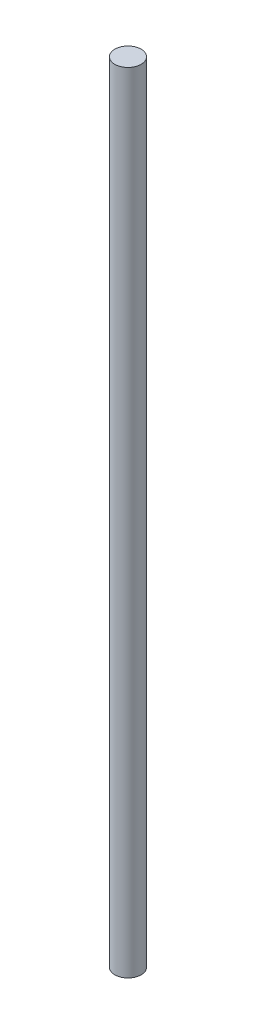
from build123d import *

# Parameters (mm, degrees)
SKETCH_1_R      = 2
EXTRUDE_1_DEPTH = 120


with BuildPart() as part:
    # 草图1 → 凸台-拉伸1 (new body)
    with BuildSketch(Plane(origin=(0, 0, 0), x_dir=(1, 0, 0), z_dir=(0, 1, 0))):
        with Locations(Location((0, 0, 0), (0, 0, 270))):
            Circle(SKETCH_1_R)
    extrude(amount=EXTRUDE_1_DEPTH)


solid = part.part
